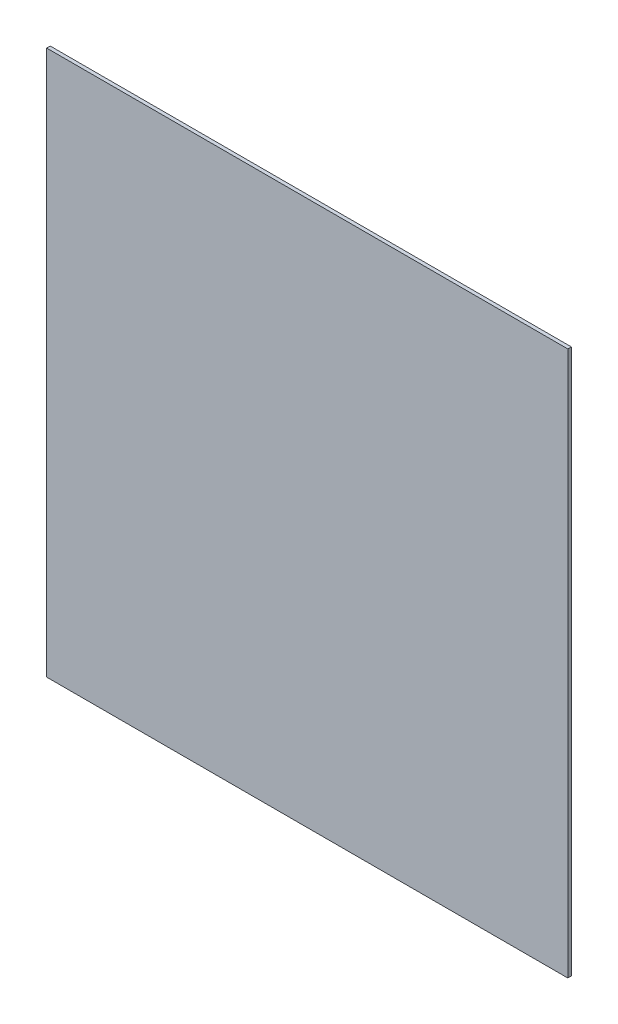
from build123d import *

# Parameters (mm, degrees)
SKETCH1_W           = 440
SKETCH1_H           = 460
BOSS_EXTRUDE1_DEPTH = 3


with BuildPart() as part:
    # Sketch1 → Boss-Extrude1 (new body)
    with BuildSketch(Plane.XY):
        Rectangle(SKETCH1_W, SKETCH1_H)
    extrude(amount=BOSS_EXTRUDE1_DEPTH)


solid = part.part
